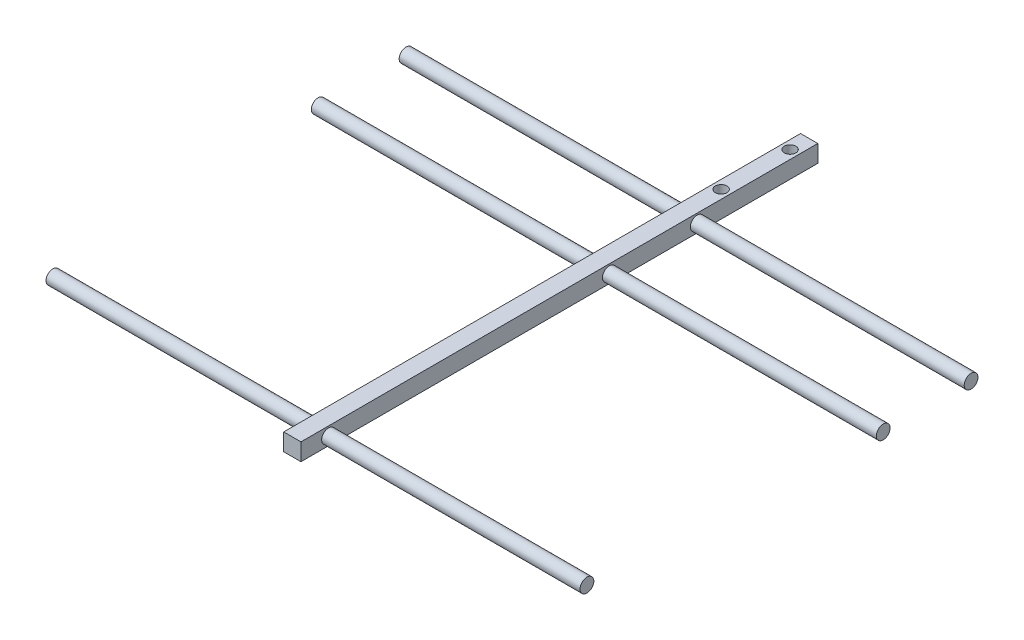
from build123d import *

# Parameters (mm, degrees)
SKETCH1_W                = 10
SKETCH1_H                = 10
BOSS_EXTRUDE1_DEPTH      = 300
SKETCH9_R                = 3.384543224
CUT_EXTRUDE1_DEPTH       = 301.208261046
BOSS_EXTRUDE7_DEPTH      = 155
BOSS_EXTRUDE7_DEPTH_BACK = 155
SKETCH3_R                = 4
BOSS_EXTRUDE8_DEPTH      = 164
BOSS_EXTRUDE8_DEPTH_BACK = 164
SKETCH3_3_R              = 4
BOSS_EXTRUDE9_DEPTH      = 164
BOSS_EXTRUDE9_DEPTH_BACK = 164
SKETCH3_4_R              = 4


with BuildPart() as part:
    # Sketch1 → Boss-Extrude1 (new body)
    with BuildSketch(Plane.XY):
        Rectangle(SKETCH1_W, SKETCH1_H)
    extrude(amount=BOSS_EXTRUDE1_DEPTH)

    # Sketch9 → Cut-Extrude1 (cut, through all)
    with BuildSketch(Plane(origin=(0, 5, 0), x_dir=(1, 0, 0), z_dir=(0, 1, 0))):
        with Locations((0, -11.099285987)):
            Circle(SKETCH9_R)
        with Locations((0, -51.099285987)):
            Circle(SKETCH9_R)
    extrude(amount=-CUT_EXTRUDE1_DEPTH, mode=Mode.SUBTRACT)

    # Sketch3 → Boss-Extrude7 (add, two sides: drawn at the far end of the back side and taken through both)
    with BuildSketch(Plane(origin=(0, 0, 0), x_dir=(0, 0, -1), z_dir=(1, 0, 0)).offset(-BOSS_EXTRUDE7_DEPTH_BACK)):
        with Locations((-284, 0)):
            Circle(SKETCH3_R)
    extrude(amount=BOSS_EXTRUDE7_DEPTH + BOSS_EXTRUDE7_DEPTH_BACK)

    # Sketch3<3> → Boss-Extrude8 (add, two sides: drawn at the far end of the back side and taken through both)
    with BuildSketch(Plane(origin=(0, 0, 0), x_dir=(0, 0, -1), z_dir=(1, 0, 0)).offset(-BOSS_EXTRUDE8_DEPTH_BACK)):
        with Locations((-70, 0)):
            Circle(SKETCH3_3_R)
    extrude(amount=BOSS_EXTRUDE8_DEPTH + BOSS_EXTRUDE8_DEPTH_BACK)

    # Sketch3<4> → Boss-Extrude9 (add, two sides: drawn at the far end of the back side and taken through both)
    with BuildSketch(Plane(origin=(0, 0, 0), x_dir=(0, 0, -1), z_dir=(1, 0, 0)).offset(-BOSS_EXTRUDE9_DEPTH_BACK)):
        with Locations((-121, 0)):
            Circle(SKETCH3_4_R)
    extrude(amount=BOSS_EXTRUDE9_DEPTH + BOSS_EXTRUDE9_DEPTH_BACK)


solid = part.part
